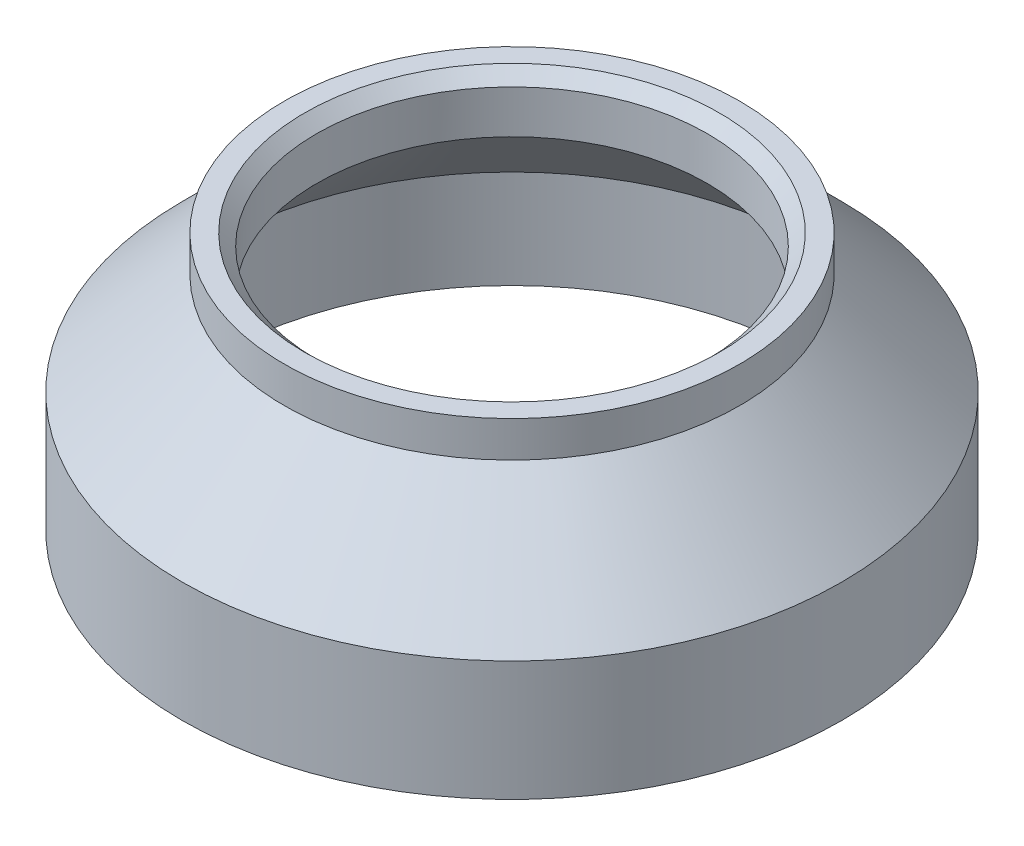
from build123d import *

# Parameters (mm, degrees)
CHAMFER1_SIZE = 1.27


with BuildPart() as part:
    # Sketch2 → Revolve1 (revolve)
    with BuildSketch(Plane.XY, mode=Mode.PRIVATE) as revolve1_sk:
        Polygon((34.925, 0), (34.925, 9.525), (24.13, 20.32), (24.13, 24.13), (20.701, 24.13), (20.701, 18.288), (31.75, 7.239), (31.75, 0), (31.75, -3.175), (34.925, -3.175), align=None)
    revolve(revolve1_sk.sketch.rotate(Axis((0, 0, 0), (0, 1, 0)), 90), axis=Axis((0, 0, 0), (0, 1, 0)))

    # Chamfer1
    chamfer1_edges = [part.edges().sort_by_distance(p)[0] for p in [
        (0, 24.13, 20.701),
    ]]
    chamfer(chamfer1_edges, length=CHAMFER1_SIZE)


solid = part.part
